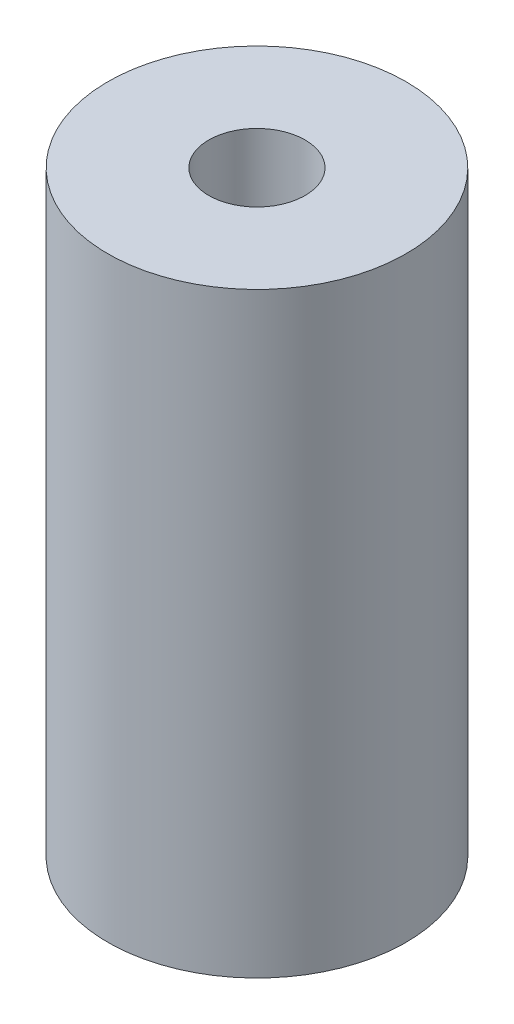
from build123d import *

# Parameters (mm, degrees)
SKETCH1_W = 5.076923077
SKETCH1_H = 30


with BuildPart() as part:
    # Sketch1 → Revolve1 (revolve)
    with BuildSketch(Plane.XY, mode=Mode.PRIVATE) as revolve1_sk:
        with Locations((4.961538461, 15)):
            Rectangle(SKETCH1_W, SKETCH1_H)
    revolve(revolve1_sk.sketch.rotate(Axis((0, 30, 0), (0, -1, 0)), 270), axis=Axis((0, 30, 0), (0, -1, 0)))


solid = part.part
